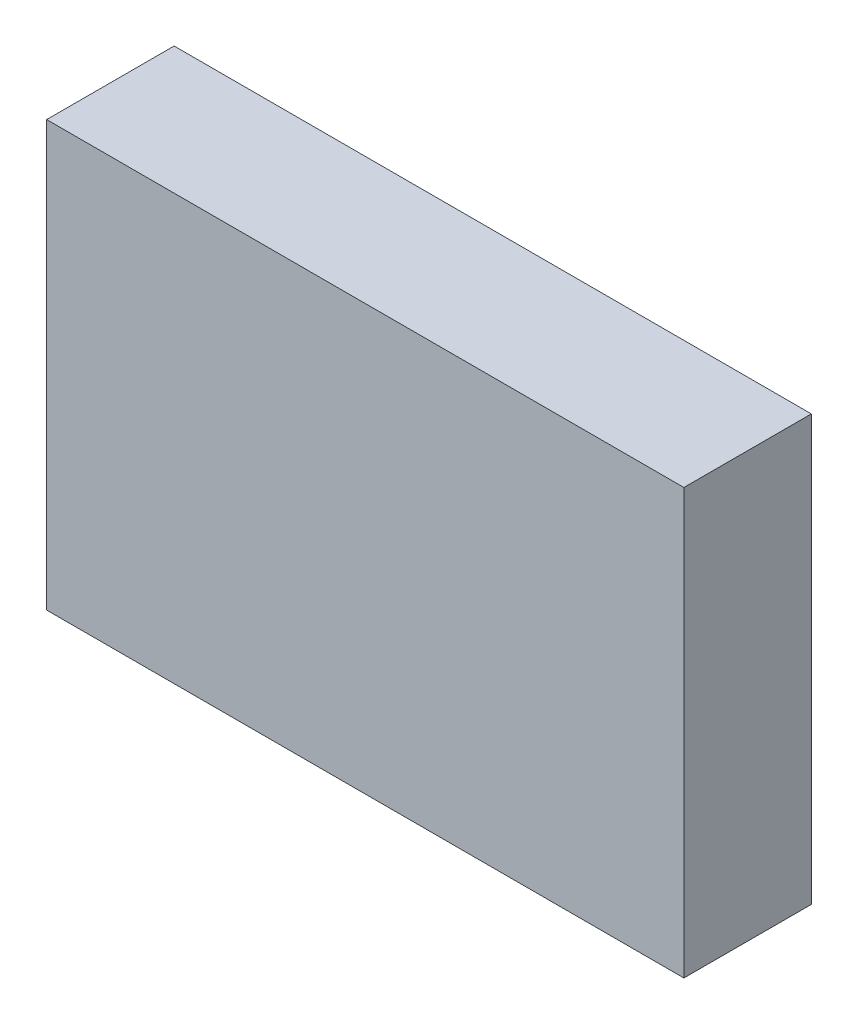
from build123d import *

# Parameters (mm, degrees)
SKETCH_1_W      = 30
SKETCH_1_H      = 20
EXTRUDE_1_DEPTH = 6


with BuildPart() as part:
    # 草图1 → 凸台-拉伸1 (new body)
    with BuildSketch(Plane.XY):
        with Locations((-6.254745975, -4.93807448)):
            Rectangle(SKETCH_1_W, SKETCH_1_H)
    extrude(amount=EXTRUDE_1_DEPTH)


solid = part.part
